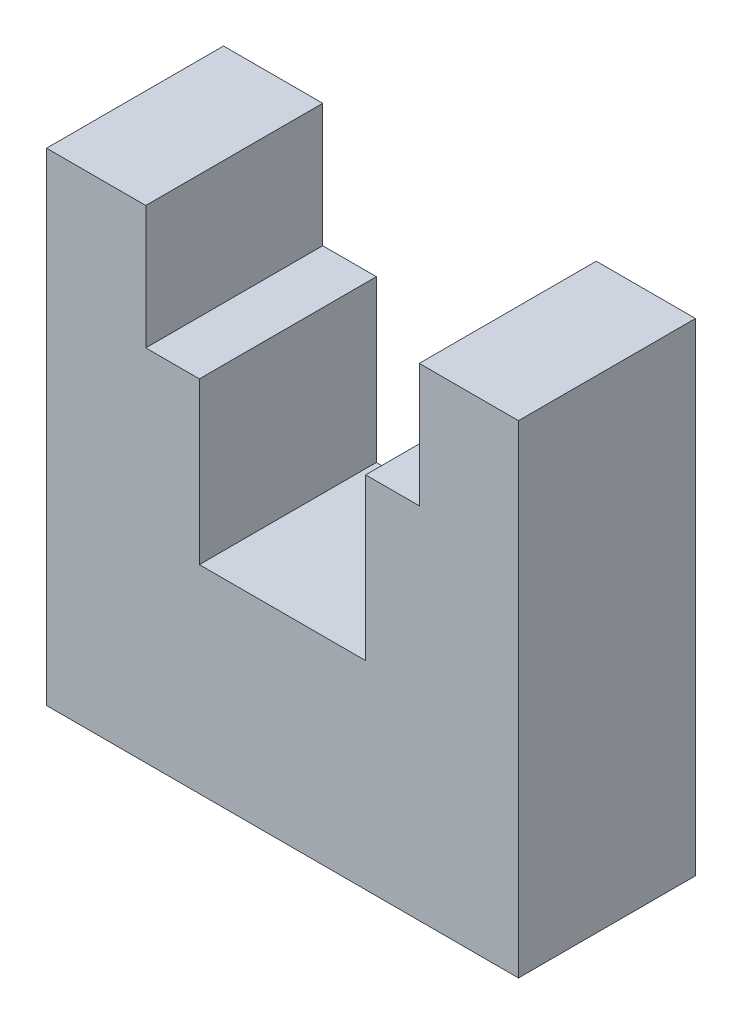
from build123d import *

# Parameters (mm, degrees)
BOSS_EXTRUDE1_DEPTH = 3.3


with BuildPart() as part:
    # Sketch1 → Boss-Extrude1 (new body)
    with BuildSketch(Plane.XY):
        Polygon((-2.55, 6.7), (-2.55, 9), (-4.4, 9), (-4.4, 0), (0, 0), (0, 3.7), (-1.55, 3.7), (-1.55, 6.7), align=None)
        Polygon((0, 3.7), (0, 0), (4.4, 0), (4.4, 9), (2.55, 9), (2.55, 6.7), (1.55, 6.7), (1.55, 3.7), align=None)
    extrude(amount=BOSS_EXTRUDE1_DEPTH)


solid = part.part
